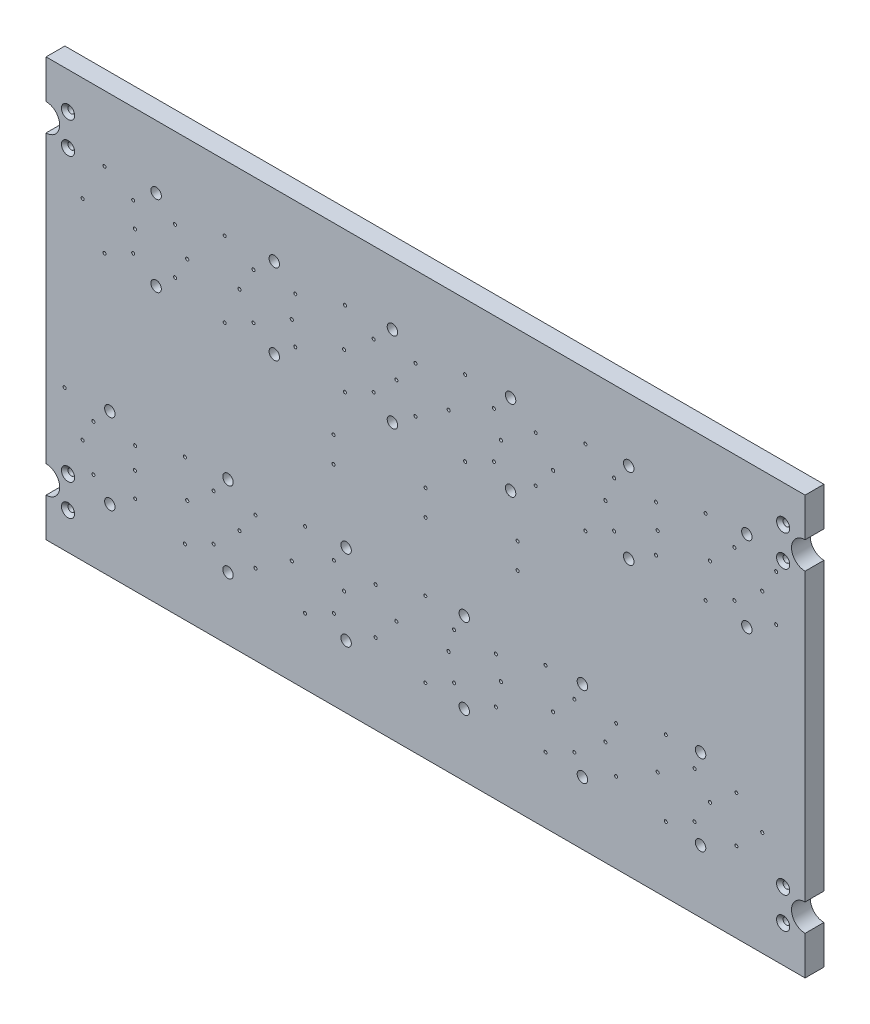
from build123d import *

# Parameters (mm, degrees)
SKETCH1_W                              = 726
SKETCH1_H                              = 400
BASESHEET_DEPTH                        = 18
CUT_EXTRUDE1_DEPTH                     = 415.840933371
CSK_FOR_M6_FLAT_HEAD_MOUNT_D           = 6.4
CSK_FOR_M6_FLAT_HEAD_MOUNT_CSINK_D     = 12.6
CSK_FOR_M6_FLAT_HEAD_MOUNT_CSINK_ANGLE = 90
FARSIDEMOUNT_COPY_1_D                  = 6.4
FARSIDEMOUNT_COPY_1_CSINK_D            = 12.6
FARSIDEMOUNT_COPY_1_CSINK_ANGLE        = 90
F_10_0_10_DIAMETER_HOLE_HARNESS_D      = 10
F_3_0_3_DIAMETER_HOLE_DIN_RAIL_D       = 3
F_2_9_2_9_DIAMETER_HOLE_CRATE_D        = 2.9
CRATEARRAY_COUNT                       = 6
CRATEARRAY_PITCH                       = 115
F_2_9_2_9_FOR_CRATES_D                 = 2.9
F_2_9_2_9_INTERFACE_HOLES_D            = 2.9


with BuildPart() as part:
    # Sketch1 → BaseSheet (new body)
    with BuildSketch(Plane.XY):
        Rectangle(SKETCH1_W, SKETCH1_H)
    extrude(amount=BASESHEET_DEPTH)

    # Sketch2 → Cut-Extrude1 (cut, through all)
    with BuildSketch(Plane.XY.offset(18)):
        with BuildLine():
            ThreePointArc((-363, 137), (-353.807611845, 140.807611845), (-350, 150))
            ThreePointArc((-350, 150), (-353.807611845, 159.192388155), (-363, 163))
            Line((-363, 163), (-363, 137))
        make_face()
        with BuildLine():
            Line((-363, 137), (-363, 163))
            ThreePointArc((-363, 163), (-376, 150), (-363, 137))
        make_face()
        with BuildLine():
            ThreePointArc((-350, -150), (-353.807611845, -140.807611845), (-363, -137))
            Line((-363, -137), (-363, -163))
            ThreePointArc((-363, -163), (-353.807611845, -159.192388155), (-350, -150))
        make_face()
        with BuildLine():
            Line((-363, -163), (-363, -137))
            ThreePointArc((-363, -137), (-376, -150), (-363, -163))
        make_face()
        with BuildLine():
            ThreePointArc((363, -163), (372.192388155, -159.192388155), (376, -150))
            ThreePointArc((376, -150), (372.192388155, -140.807611845), (363, -137))
            Line((363, -137), (363, -163))
        make_face()
        with BuildLine():
            Line((363, -163), (363, -137))
            ThreePointArc((363, -137), (350, -150), (363, -163))
        make_face()
        with BuildLine():
            ThreePointArc((363, 163), (350, 150), (363, 137))
            Line((363, 137), (363, 163))
        make_face()
        with BuildLine():
            Line((363, 163), (363, 137))
            ThreePointArc((363, 137), (372.192388155, 140.807611845), (376, 150))
            ThreePointArc((376, 150), (372.192388155, 159.192388155), (363, 163))
        make_face()
    extrude(amount=-CUT_EXTRUDE1_DEPTH, mode=Mode.SUBTRACT)

    # CSK for M6 Flat Head - Mount (through all)
    with Locations(Plane.XY.offset(18)):
        with Locations((-342, 165), (-342, 135)):
            csk_for_m6_flat_head_mount = CounterSinkHole(CSK_FOR_M6_FLAT_HEAD_MOUNT_D / 2, CSK_FOR_M6_FLAT_HEAD_MOUNT_CSINK_D / 2, counter_sink_angle=CSK_FOR_M6_FLAT_HEAD_MOUNT_CSINK_ANGLE)

    # AnotherSideMount: CSK for M6 Flat Head - Mount across plane
    add(csk_for_m6_flat_head_mount.mirror(Plane.ZX), mode=Mode.SUBTRACT)

    # FarSideMount: CSK for M6 Flat Head - Mount across plane
    add(csk_for_m6_flat_head_mount.mirror(Plane(origin=(0, 0, 0), x_dir=(0, 0, 1), z_dir=(1, 0, 0))), mode=Mode.SUBTRACT)

    # FarSideMount copy 1 (through all)
    with Locations(Plane(origin=(0, 0, 18), x_dir=(-1, 0, 0), z_dir=(0, 0, 1))):
        with Locations((-342, 165), (-342, 135)):
            CounterSinkHole(FARSIDEMOUNT_COPY_1_D / 2, FARSIDEMOUNT_COPY_1_CSINK_D / 2, counter_sink_angle=FARSIDEMOUNT_COPY_1_CSINK_ANGLE)

    # Ø10.0 (10) Diameter Hole harness (through all)
    with Locations(Plane.XY.offset(18)):
        with Locations((-257.719403218, 139.808622438), (-257.719403218, 62.808622438), (-144.719403218, 139.808622438), (-31.719403218, 139.808622438), (81.280596782, 139.808622438), (194.280596782, 139.808622438), (307.280596782, 139.808622438), (-144.719403218, 62.808622438), (-31.719403218, 62.808622438), (81.280596782, 62.808622438), (194.280596782, 62.808622438), (307.280596782, 62.808622438), (-302, -63), (-302, -140), (-189, -140), (-189, -63), (-76, -63), (-76, -140), (37, -63), (37, -140), (150, -63), (150, -140), (263, -63), (263, -140)):
            Hole(F_10_0_10_DIAMETER_HOLE_HARNESS_D / 2)

    # Ø3.0 (3) Diameter Hole DIN rail (through all)
    with Locations(Plane.XY.offset(18)):
        with Locations((-328, -100), (-328, 100), (-278, -100), (-278, 100), (-228, -100), (-228, 100), (-178, -100), (-178, 100), (-128, -100), (-128, 100), (-78, -100), (-78, 100), (-28, -100), (-28, 100), (22, -100), (22, 100), (72, -100), (72, 100), (122, -100), (122, 100), (172, -100), (172, 100), (222, -100), (222, 100), (272, -100), (272, 100), (322, -100), (322, 100)):
            Hole(F_3_0_3_DIAMETER_HOLE_DIN_RAIL_D / 2)

    # Ø2.9 (2.9) Diameter Hole crate (through all)
    with Locations(Plane.XY.offset(18)):
        with Locations((-279.65, 122.9), (-239.65, 122.9), (-279.65, 78.9), (-239.65, 78.9), (-307.15, 65.25), (-307.15, 137.25), (-317.75, -79.4), (-277.75, -79.4), (-317.75, -123.4), (-277.75, -123.4), (-345.25, -65.05)):
            f_2_9_2_9_diameter_hole_crate = Hole(F_2_9_2_9_DIAMETER_HOLE_CRATE_D / 2)

    # CrateArray: Ø2.9 (2.9) Diameter Hole crate ×6
    with Locations(*[(i * CRATEARRAY_PITCH, 0, 0) for i in range(1, CRATEARRAY_COUNT)]):
        add(f_2_9_2_9_diameter_hole_crate, mode=Mode.SUBTRACT)

    # Ø2.9 (2.9) for crates (through all)
    with Locations(Plane.XY.offset(18)):
        with Locations((-230.25, -137.05), (-115.25, -137.05), (-0.25, -137.05), (114.75, -137.05), (229.75, -137.05)):
            Hole(F_2_9_2_9_FOR_CRATES_D / 2)

    # Ø2.9 (2.9) interface holes (through all)
    with Locations(Plane.XY.offset(18)):
        with Locations((0, 0), (0, 24.5), (-88, 0), (-88, 24.5), (88, 0), (88, 24.5)):
            Hole(F_2_9_2_9_INTERFACE_HOLES_D / 2)


solid = part.part
